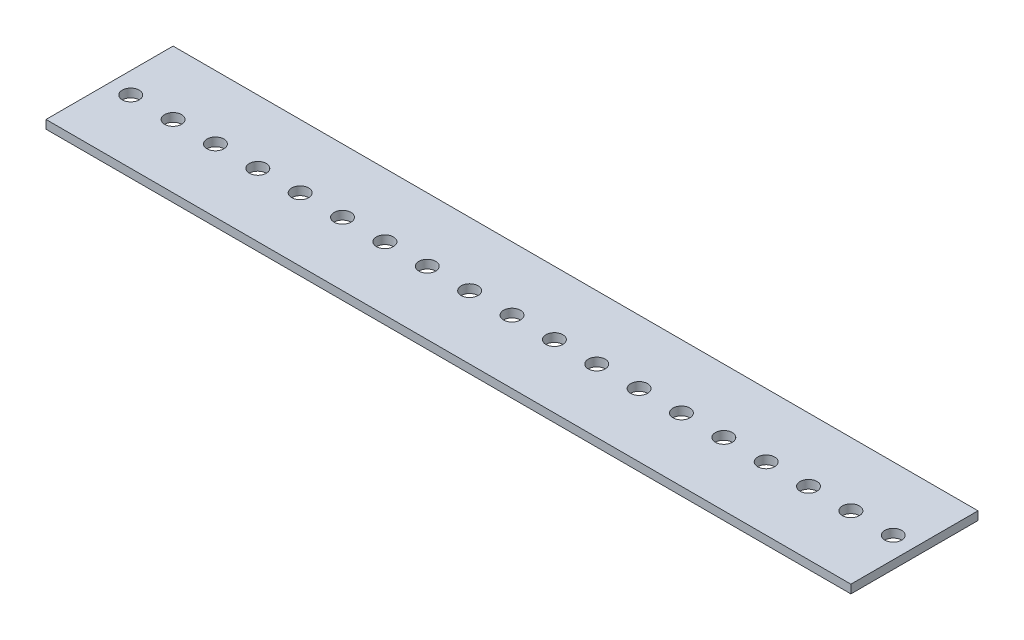
from build123d import *

# Parameters (mm, degrees)
SKETCH1_W           = 241.3
SKETCH1_H           = 38.1
BOSS_EXTRUDE1_DEPTH = 2.54
SKETCH2_R           = 2.54
CUT_EXTRUDE1_DEPTH  = 2.54
LPATTERN1_COUNT     = 19
LPATTERN1_PITCH     = 12.7


with BuildPart() as part:
    # Sketch1 → Boss-Extrude1 (new body)
    with BuildSketch(Plane(origin=(0, 0, 0), x_dir=(1, 0, 0), z_dir=(0, 1, 0))):
        Rectangle(SKETCH1_W, SKETCH1_H)
    extrude(amount=BOSS_EXTRUDE1_DEPTH)

    # Sketch2 → Cut-Extrude1 (cut)
    with BuildSketch(Plane(origin=(0, 2.54, 0), x_dir=(1, 0, 0), z_dir=(0, 1, 0))):
        with Locations(Location((-114.3, 0, 0), (0, 0, 270))):
            Circle(SKETCH2_R)
    cut_extrude1 = extrude(amount=-CUT_EXTRUDE1_DEPTH, mode=Mode.SUBTRACT)

    # LPattern1: Cut-Extrude1 ×19
    with Locations(*[(i * LPATTERN1_PITCH, 0, 0) for i in range(1, LPATTERN1_COUNT)]):
        add(cut_extrude1, mode=Mode.SUBTRACT)


solid = part.part
